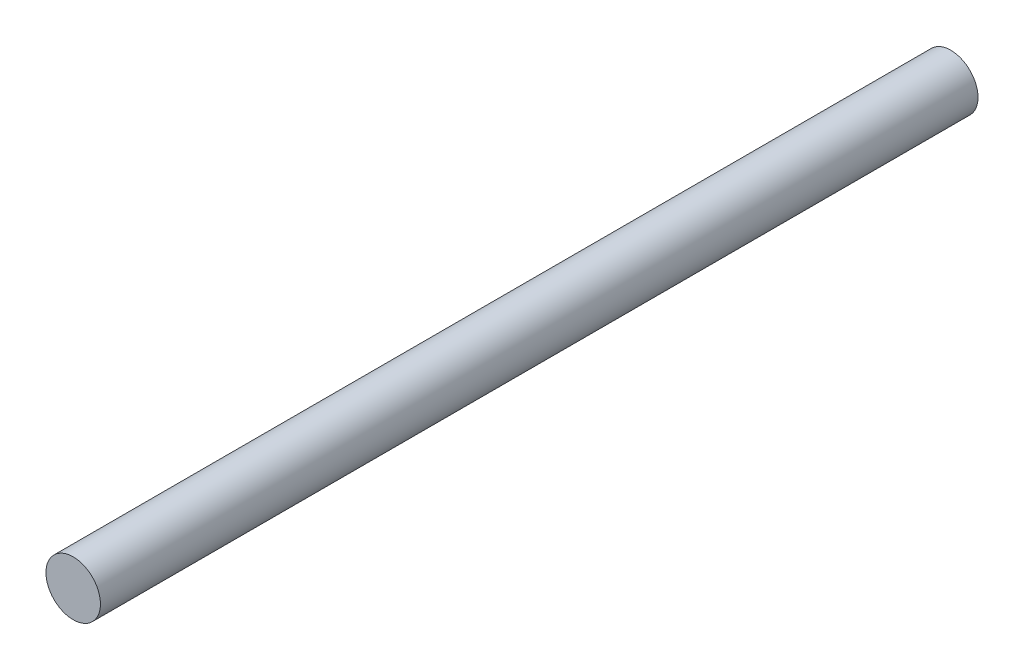
from build123d import *

# Parameters (mm, degrees)
BOSS_EXTRUDE1_DEPTH      = 3.2
BOSS_EXTRUDE1_DEPTH_BACK = 283.2
SKETCH1_R                = 8.89


with BuildPart() as part:
    # Sketch1 → Boss-Extrude1 (new, two sides: drawn at the far end of the back side and taken through both)
    with BuildSketch(Plane.XY.offset(-BOSS_EXTRUDE1_DEPTH_BACK)):
        Circle(SKETCH1_R)
    extrude(amount=BOSS_EXTRUDE1_DEPTH + BOSS_EXTRUDE1_DEPTH_BACK)


solid = part.part
